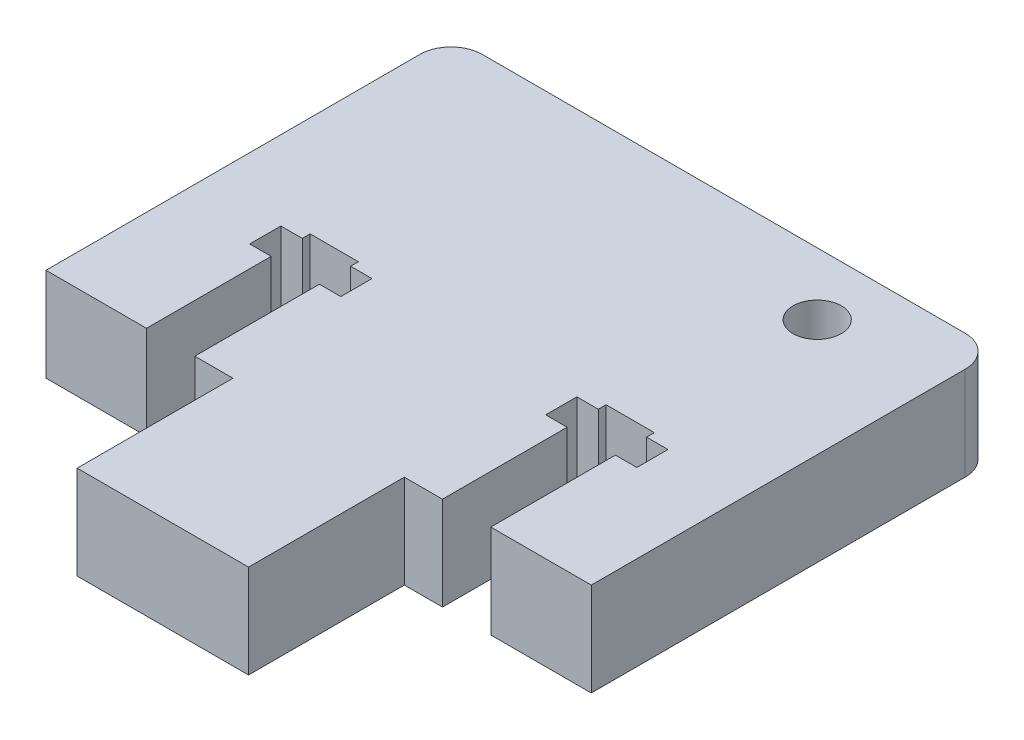
from build123d import *

# Parameters (mm, degrees)
DODANIE_WYCI_GNI_CIE1_DEPTH      = 20
DODANIE_WYCI_GNI_CIE1_DEPTH_BACK = 6
SZKIC1_W                         = 35
SZKIC1_H                         = 6
WYTNIJ_WYCI_GNI_CIE1_DEPTH       = 112.693205508
SZKIC4_R                         = 1.55
WYTNIJ_WYCI_GNI_CIE2_DEPTH       = 6
SZKIC6_W                         = 11
SZKIC6_H                         = 6
DODANIE_WYCI_GNI_CIE2_DEPTH      = 10
SZYK_LINIOWY1_COUNT              = 2
SZYK_LINIOWY1_PITCH              = 19
WYTNIJ_WYCI_GNI_CIE3_DEPTH       = 6


with BuildPart() as part:
    # Szkic1 → Dodanie-wyciągnięcie1 (new, two sides: drawn at the far end of the back side and taken through both)
    with BuildSketch(Plane.XY.offset(-DODANIE_WYCI_GNI_CIE1_DEPTH_BACK)):
        with Locations((92.224072822, -85.062373271)):
            Rectangle(SZKIC1_W, SZKIC1_H)
    extrude(amount=DODANIE_WYCI_GNI_CIE1_DEPTH + DODANIE_WYCI_GNI_CIE1_DEPTH_BACK)

    # Szkic3 → Wytnij-wyciągnięcie1 (cut, through all)
    with BuildSketch(Plane.XZ.offset(88.062373271)):
        Polygon((103.274072822, 20), (100.174072822, 20), (100.174072822, 12), (98.799072822, 12), (98.799072822, 10), (100.174072822, 10), (100.174072822, 9.5), (103.274072822, 9.5), (103.274072822, 10), (104.649072822, 10), (104.649072822, 12), (103.274072822, 12), align=None)
    wytnij_wyci_gni_cie1 = extrude(amount=-WYTNIJ_WYCI_GNI_CIE1_DEPTH, mode=Mode.SUBTRACT)

    # Szkic4 → Wytnij-wyciągnięcie2 (cut)
    with BuildSketch(Plane.XZ.offset(88.062373271)):
        with Locations(Location((102.224072822, -2, 0), (0, 0, 270))):
            Circle(SZKIC4_R)
    extrude(amount=-WYTNIJ_WYCI_GNI_CIE2_DEPTH, mode=Mode.SUBTRACT)

    # Szkic6 → Dodanie-wyciągnięcie2 (add)
    with BuildSketch(Plane.XY.offset(20)):
        with Locations((92.224072822, -85.062373271)):
            Rectangle(SZKIC6_W, SZKIC6_H)
    extrude(amount=DODANIE_WYCI_GNI_CIE2_DEPTH)

    # Szyk liniowy1: Wytnij-wyciągnięcie1 ×2
    with Locations(*[(-i * SZYK_LINIOWY1_PITCH, 0, 0) for i in range(1, SZYK_LINIOWY1_COUNT)]):
        add(wytnij_wyci_gni_cie1, mode=Mode.SUBTRACT)

    # Szkic7 → Wytnij-wyciągnięcie3 (cut)
    with BuildSketch(Plane.XZ.offset(88.062373271)):
        with BuildLine():
            Line((109.724072822, -4), (109.724072822, -6))
            Line((109.724072822, -6), (107.724072822, -6))
            ThreePointArc((107.724072822, -6), (109.138286384, -5.414213562), (109.724072822, -4))
        make_face()
        with BuildLine():
            Line((76.724072822, -6), (74.724072822, -6))
            Line((74.724072822, -6), (74.724072822, -4))
            ThreePointArc((74.724072822, -4), (75.30985926, -5.414213562), (76.724072822, -6))
        make_face()
    extrude(amount=-WYTNIJ_WYCI_GNI_CIE3_DEPTH, mode=Mode.SUBTRACT)


solid = part.part
